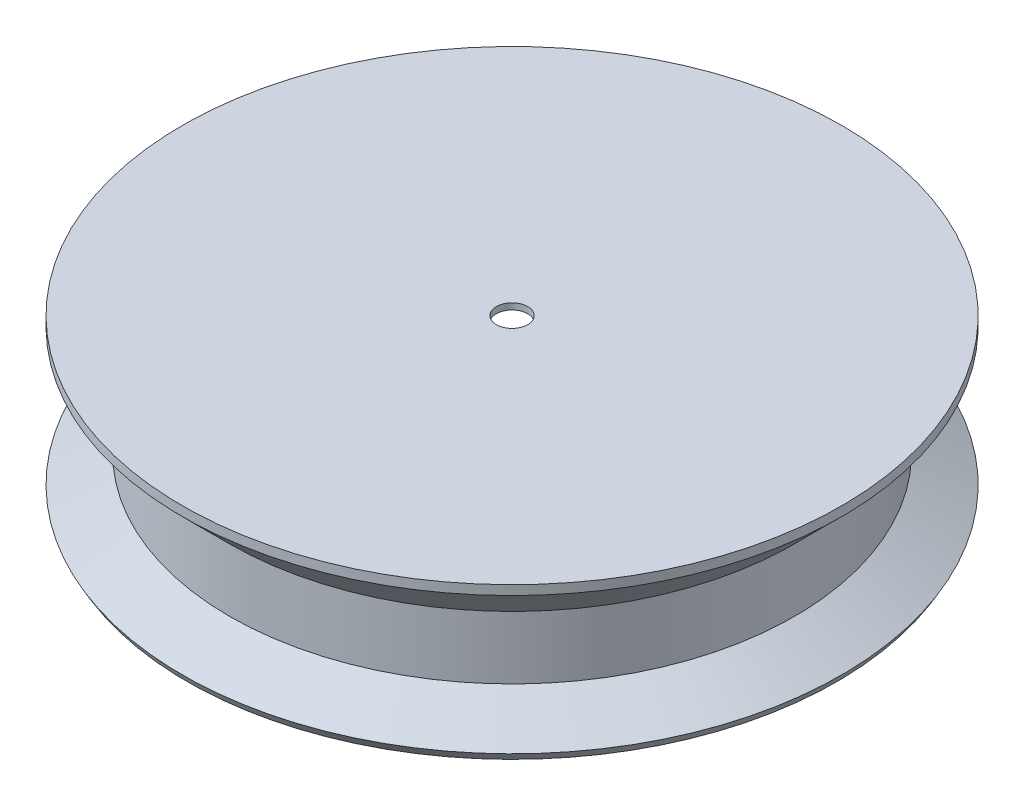
from build123d import *


with BuildPart() as part:
    # Esquisse1 → Révolution1 (revolve)
    with BuildSketch(Plane.XY, mode=Mode.PRIVATE) as r_volution1_sk:
        Polygon((-5, 0), (-105, 0), (-105, -3), (-90, -18), (-90, -38), (-105, -46.660254038), (-103.490796686, -49.274270857), (-80, -49.274270857), (-80, -47.274270857), (-102.063508327, -47.274270857), (-88, -39.154700538), (-88, -17.171572875), (-103, -2), (-5, -2), align=None)
    revolve(r_volution1_sk.sketch.rotate(Axis((0, -51.737984399, 0), (0, 1, 0)), 270), axis=Axis((0, -51.737984399, 0), (0, 1, 0)))


solid = part.part
